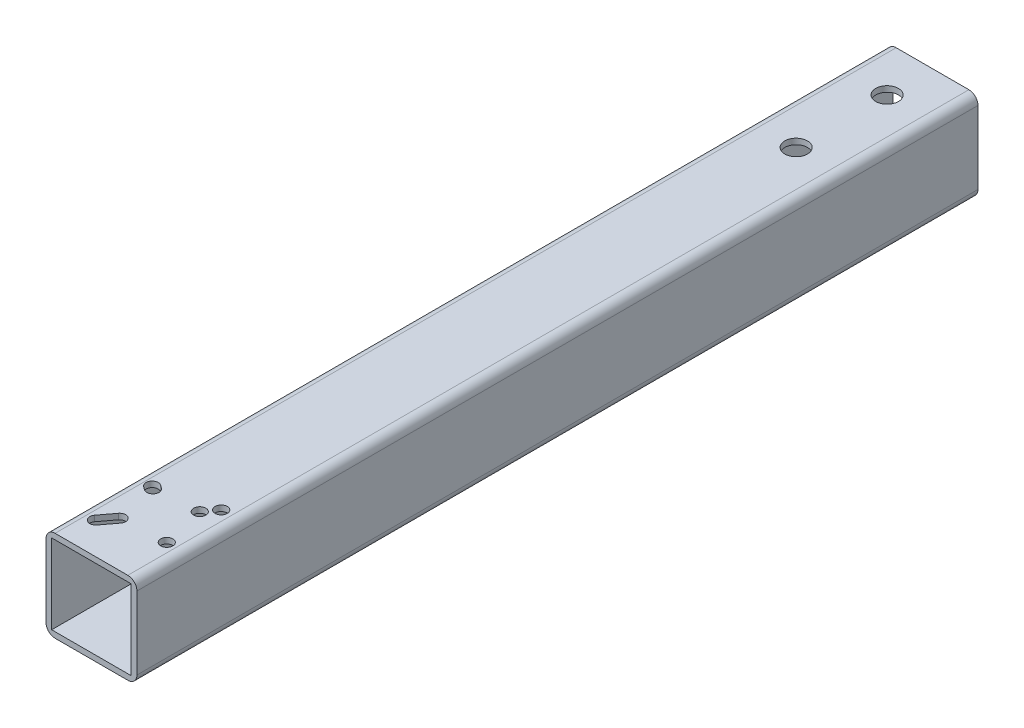
from build123d import *

# Parameters (mm, degrees)
SKETCH1_W           = 25.4
SKETCH1_H           = 25.4
SKETCH1_W_2         = 22.225
SKETCH1_H_2         = 22.225
BOSS_EXTRUDE1_DEPTH = 234.95
FILLET1_R           = 2.54
SKETCH2_R           = 3.175
CUT_EXTRUDE1_DEPTH  = 238.560919126
SKETCH3_R           = 1.7
CUT_EXTRUDE2_DEPTH  = 2.54


with BuildPart() as part:
    # Sketch1 → Boss-Extrude1 (new body)
    with BuildSketch(Plane.XY):
        with Locations((-11.559591837, -1.275183673)):
            Rectangle(SKETCH1_W, SKETCH1_H)
        with Locations((-11.559591837, -1.275183673)):
            Rectangle(SKETCH1_W_2, SKETCH1_H_2, mode=Mode.SUBTRACT)
    extrude(amount=BOSS_EXTRUDE1_DEPTH)

    # Fillet1
    fillet1_edges = [part.edges().sort_by_distance(p)[0] for p in [
        (-24.259591837, 11.424816327, 117.475),
        (1.140408163, 11.424816327, 117.475),
        (1.140408163, -13.975183673, 117.475),
        (-24.259591837, -13.975183673, 117.475),
    ]]
    fillet(fillet1_edges, radius=FILLET1_R)

    # Sketch2 → Cut-Extrude1 (cut, through all)
    with BuildSketch(Plane(origin=(0, 11.424816327, 0), x_dir=(1, 0, 0), z_dir=(0, 1, 0))):
        with Locations(Location((-11.559591837, -12.7, 0), (0, 0, 270))):
            Circle(SKETCH2_R)
        with Locations(Location((-11.559591837, -38.1, 0), (0, 0, 270))):
            Circle(SKETCH2_R)
    extrude(amount=-CUT_EXTRUDE1_DEPTH, mode=Mode.SUBTRACT)

    # Sketch3 → Cut-Extrude2 (cut)
    with BuildSketch(Plane(origin=(0, 11.424816327, 0), x_dir=(1, 0, 0), z_dir=(0, 1, 0))):
        with Locations(Location((-6.745071652, -209.51091592, 0), (0, 0, 270))):
            Circle(SKETCH3_R)
        with Locations(Location((-4.172146269, -206.096528614, 0), (0, 0, 270))):
            Circle(SKETCH3_R)
        with Locations(Location((-3.921994623, -221.549522883, 0), (0, 0, 270))):
            Circle(SKETCH3_R)
        with BuildLine():
            Line((-15.016431655, -223.31216962), (-17.859841481, -227.085501905))
            ThreePointArc((-17.859841481, -227.085501905), (-20.240607387, -227.420096733), (-20.575202215, -225.039330826))
            Line((-20.575202215, -225.039330826), (-17.731792389, -221.265998541))
            ThreePointArc((-17.731792389, -221.265998541), (-15.351026483, -220.931403713), (-15.016431655, -223.31216962))
        make_face()
        with BuildLine():
            Line((-18.594632259, -208.581648392), (-17.777811336, -209.185849998))
            ThreePointArc((-17.777811336, -209.185849998), (-17.422050667, -211.563545173), (-19.799745842, -211.919305842))
            Line((-19.799745842, -211.919305842), (-20.616566765, -211.315104237))
            ThreePointArc((-20.616566765, -211.315104237), (-20.972327435, -208.937409062), (-18.594632259, -208.581648392))
        make_face()
    extrude(amount=-CUT_EXTRUDE2_DEPTH, mode=Mode.SUBTRACT)


solid = part.part
